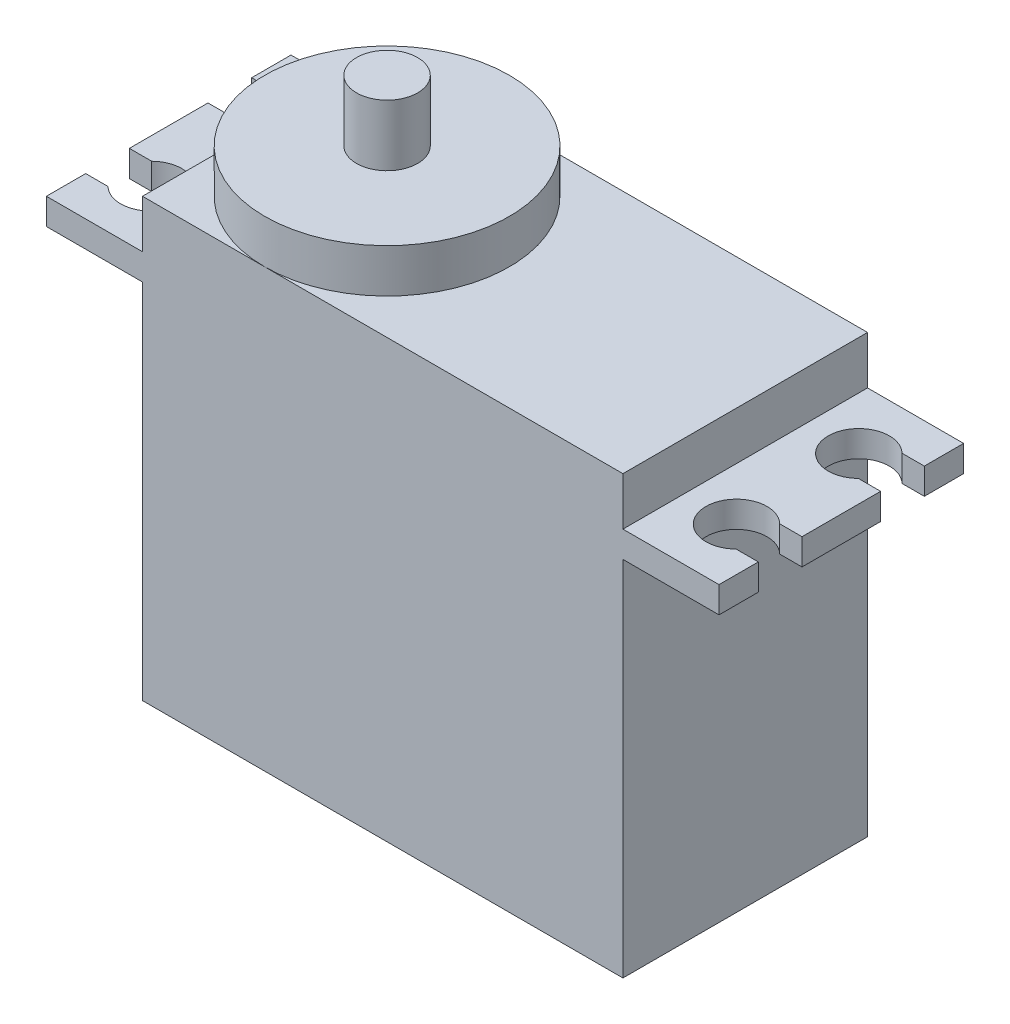
from build123d import *

# Parameters (mm, degrees)
SKETCH1_W           = 55
SKETCH1_H           = 28
BOSS_EXTRUDE1_DEPTH = 50
SKETCH2_R           = 14
BOSS_EXTRUDE2_DEPTH = 5
SKETCH3_R           = 3.5
BOSS_EXTRUDE3_DEPTH = 7
SKETCH4_W           = 11
SKETCH4_H           = 28
BOSS_EXTRUDE4_DEPTH = 3
CUT_EXTRUDE1_DEPTH  = 3


with BuildPart() as part:
    # Sketch1 → Boss-Extrude1 (new body)
    with BuildSketch(Plane(origin=(0, 0, 0), x_dir=(1, 0, 0), z_dir=(0, 1, 0))):
        Rectangle(SKETCH1_W, SKETCH1_H)
    extrude(amount=BOSS_EXTRUDE1_DEPTH)

    # Sketch2 → Boss-Extrude2 (add)
    with BuildSketch(Plane(origin=(0, 50, 0), x_dir=(1, 0, 0), z_dir=(0, 1, 0))):
        with Locations(Location((-13.5, 0, 0), (0, 0, 270))):
            Circle(SKETCH2_R)
    extrude(amount=BOSS_EXTRUDE2_DEPTH)

    # Sketch3 → Boss-Extrude3 (add)
    with BuildSketch(Plane(origin=(0, 55, 0), x_dir=(1, 0, 0), z_dir=(0, 1, 0))):
        with Locations(Location((-13.5, 0, 0), (0, 0, 270))):
            Circle(SKETCH3_R)
    extrude(amount=BOSS_EXTRUDE3_DEPTH)

    # Sketch4 → Boss-Extrude4 (add)
    with BuildSketch(Plane(origin=(0, 41.5, 0), x_dir=(1, 0, 0), z_dir=(0, 1, 0))):
        with Locations((33, 0)):
            Rectangle(SKETCH4_W, SKETCH4_H)
        with Locations((-33, 0)):
            Rectangle(SKETCH4_W, SKETCH4_H)
    extrude(amount=BOSS_EXTRUDE4_DEPTH)

    # Sketch5 → Cut-Extrude1 (cut)
    with BuildSketch(Plane(origin=(0, 41.5, 0), x_dir=(1, 0, 0), z_dir=(0, 1, 0))):
        with BuildLine():
            Line((35.949489743, 4.5), (38.5, 4.5))
            Line((38.5, 4.5), (38.5, 9.5))
            Line((38.5, 9.5), (35.949489743, 9.5))
            ThreePointArc((35.949489743, 9.5), (30, 7), (35.949489743, 4.5))
        make_face()
        with BuildLine():
            Line((38.5, -9.5), (38.5, -4.5))
            Line((38.5, -4.5), (35.949489743, -4.5))
            ThreePointArc((35.949489743, -4.5), (30, -7), (35.949489743, -9.5))
            Line((35.949489743, -9.5), (38.5, -9.5))
        make_face()
        with BuildLine():
            Line((-35.949489743, -4.5), (-38.5, -4.5))
            Line((-38.5, -4.5), (-38.5, -9.5))
            Line((-38.5, -9.5), (-35.949489743, -9.5))
            ThreePointArc((-35.949489743, -9.5), (-30, -7), (-35.949489743, -4.5))
        make_face()
        with BuildLine():
            Line((-38.5, 9.5), (-38.5, 4.5))
            Line((-38.5, 4.5), (-35.949489743, 4.5))
            ThreePointArc((-35.949489743, 4.5), (-30, 7), (-35.949489743, 9.5))
            Line((-35.949489743, 9.5), (-38.5, 9.5))
        make_face()
    extrude(amount=CUT_EXTRUDE1_DEPTH, mode=Mode.SUBTRACT)


solid = part.part
